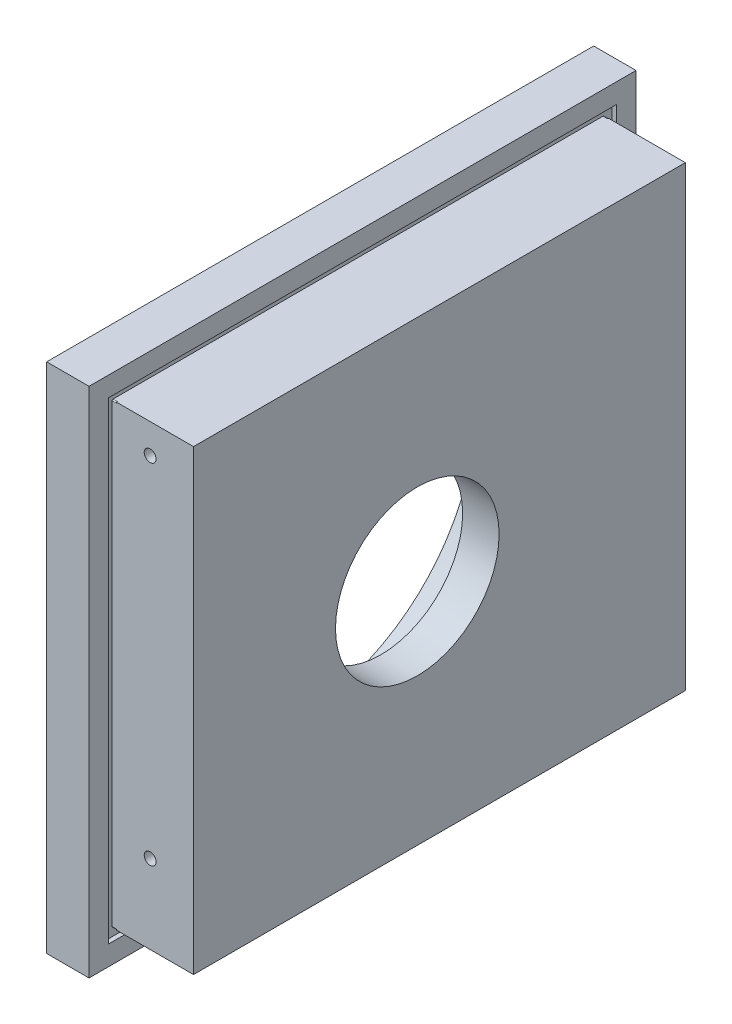
from build123d import *

# Parameters (mm, degrees)
SKETCH1_W                  = 300
SKETCH1_H                  = 260
BOSS_EXTRUDE1_DEPTH        = 60.5
SKETCH2_R                  = 90.15
CUT_EXTRUDE1_DEPTH         = 42
SKETCH9_R                  = 41.51
CUT_EXTRUDE9_DEPTH         = 306
SKETCH12_W                 = 39
SKETCH12_H                 = 260
CUT_EXTRUDE12_DEPTH        = 36.45
SKETCH13_W                 = 39
SKETCH13_H                 = 260
CUT_EXTRUDE13_DEPTH        = 14
SKETCH14_W                 = 39
SKETCH14_H                 = 249.55
CUT_EXTRUDE14_DEPTH        = 14
SKETCH15_W                 = 22.45
SKETCH15_H                 = 260
CUT_EXTRUDE15_DEPTH        = 208.50963833
F_6_0MM_DOWEL_HOLE1_D      = 6
F_6_0MM_DOWEL_HOLE1_DEPTH  = 30
F_6_0MM_DOWEL_HOLE1_TIP    = 1.802581857
F_6_0MM_DOWEL_HOLE2_D      = 6
F_6_0MM_DOWEL_HOLE2_DEPTH  = 30
F_6_0MM_DOWEL_HOLE2_TIP    = 1.802581857
F_6_0MM_DOWEL_HOLE3_D      = 6
F_6_0MM_DOWEL_HOLE3_DEPTH  = 15
F_6_0MM_DOWEL_HOLE3_TIP    = 1.802581857
SKETCH25_W                 = 39
SKETCH25_H                 = 14
CUT_EXTRUDE16_DEPTH        = 313.400788251
SKETCH26_W                 = 257.55
SKETCH26_H                 = 240
CUT_EXTRUDE17_DEPTH        = 2.3
F_10_0MM_DOWEL_HOLE1_D     = 10
F_10_0MM_DOWEL_HOLE1_DEPTH = 15
F_10_0MM_DOWEL_HOLE1_TIP   = 3.004303095
SKETCH31_R                 = 95.65
SKETCH31_R_2               = 91.65
CUT_EXTRUDE18_DEPTH        = 2.3
SKETCH32_R                 = 2.25
CUT_EXTRUDE19_DEPTH        = 68


with BuildPart() as part:
    # Sketch1 → Boss-Extrude1 (new body)
    with BuildSketch(Plane(origin=(0, 0, 0), x_dir=(0, 0, -1), z_dir=(1, 0, 0))):
        Rectangle(SKETCH1_W, SKETCH1_H)
    extrude(amount=BOSS_EXTRUDE1_DEPTH)

    # Sketch2 → Cut-Extrude1 (cut)
    with BuildSketch(Plane(origin=(0, 0, 0), x_dir=(0, 0, -1), z_dir=(1, 0, 0))):
        with Locations(Location((0, 0, 0), (0, 0, 180))):
            Circle(SKETCH2_R)
    extrude(amount=CUT_EXTRUDE1_DEPTH, mode=Mode.SUBTRACT)

    # Sketch9 → Cut-Extrude9 (cut)
    with BuildSketch(Plane(origin=(0, 0, 0), x_dir=(0, 0, -1), z_dir=(1, 0, 0))):
        with Locations(Location((0, 0, 0), (0, 0, 180))):
            Circle(SKETCH9_R)
    extrude(amount=CUT_EXTRUDE9_DEPTH, mode=Mode.SUBTRACT)

    # Sketch12 → Cut-Extrude12 (cut)
    with BuildSketch(Plane.XY.offset(150)):
        with Locations((41, 0)):
            Rectangle(SKETCH12_W, SKETCH12_H)
    extrude(amount=-CUT_EXTRUDE12_DEPTH, mode=Mode.SUBTRACT)

    # Sketch13 → Cut-Extrude13 (cut)
    with BuildSketch(Plane(origin=(0, 0, -150), x_dir=(-1, 0, 0), z_dir=(0, 0, -1))):
        with Locations((-41, 0)):
            Rectangle(SKETCH13_W, SKETCH13_H)
    extrude(amount=-CUT_EXTRUDE13_DEPTH, mode=Mode.SUBTRACT)

    # Sketch14 → Cut-Extrude14 (cut)
    with BuildSketch(Plane(origin=(0, -130, 0), x_dir=(-1, 0, 0), z_dir=(0, -1, 0))):
        with Locations((-41, 11.225)):
            Rectangle(SKETCH14_W, SKETCH14_H)
    extrude(amount=-CUT_EXTRUDE14_DEPTH, mode=Mode.SUBTRACT)

    # Sketch15 → Cut-Extrude15 (cut, through all)
    with BuildSketch(Plane(origin=(0, 0, 0), x_dir=(0, 0, -1), z_dir=(1, 0, 0))):
        with Locations((-138.775, 0)):
            Rectangle(SKETCH15_W, SKETCH15_H)
    extrude(amount=CUT_EXTRUDE15_DEPTH, mode=Mode.SUBTRACT)

    # Ø6.0mm Dowel Hole1
    with Locations(Plane(origin=(0, 0, -136), x_dir=(-1, 0, 0), z_dir=(0, 0, -1))):
        with Locations((-38.5, 101), (-38.5, -76)):
            Hole(F_6_0MM_DOWEL_HOLE1_D / 2, depth=F_6_0MM_DOWEL_HOLE1_DEPTH)
            with Locations((0, 0, -(F_6_0MM_DOWEL_HOLE1_DEPTH + F_6_0MM_DOWEL_HOLE1_TIP / 2))):  # 118° drill point
                Cone(0, F_6_0MM_DOWEL_HOLE1_D / 2, F_6_0MM_DOWEL_HOLE1_TIP, mode=Mode.SUBTRACT)

    # Ø6.0mm Dowel Hole2
    with Locations(Plane.XY.offset(113.55)):
        with Locations((38.5, 101), (38.5, -76)):
            Hole(F_6_0MM_DOWEL_HOLE2_D / 2, depth=F_6_0MM_DOWEL_HOLE2_DEPTH)
            with Locations((0, 0, -(F_6_0MM_DOWEL_HOLE2_DEPTH + F_6_0MM_DOWEL_HOLE2_TIP / 2))):  # 118° drill point
                Cone(0, F_6_0MM_DOWEL_HOLE2_D / 2, F_6_0MM_DOWEL_HOLE2_TIP, mode=Mode.SUBTRACT)

    # Ø6.0mm Dowel Hole3
    with Locations(Plane(origin=(0, -116, 0), x_dir=(-1, 0, 0), z_dir=(0, -1, 0))):
        with Locations((-40, -97.55), (-40, 120)):
            Hole(F_6_0MM_DOWEL_HOLE3_D / 2, depth=F_6_0MM_DOWEL_HOLE3_DEPTH)
            with Locations((0, 0, -(F_6_0MM_DOWEL_HOLE3_DEPTH + F_6_0MM_DOWEL_HOLE3_TIP / 2))):  # 118° drill point
                Cone(0, F_6_0MM_DOWEL_HOLE3_D / 2, F_6_0MM_DOWEL_HOLE3_TIP, mode=Mode.SUBTRACT)

    # Sketch25 → Cut-Extrude16 (cut, through all)
    with BuildSketch(Plane(origin=(0, 0, -150), x_dir=(-1, 0, 0), z_dir=(0, 0, -1))):
        with Locations((-41, 123)):
            Rectangle(SKETCH25_W, SKETCH25_H)
    extrude(amount=-CUT_EXTRUDE16_DEPTH, mode=Mode.SUBTRACT)

    # Sketch26 → Cut-Extrude17 (cut)
    with BuildSketch(Plane(origin=(21.5, 0, 0), x_dir=(0, 0, -1), z_dir=(1, 0, 0))):
        with Locations((11.225, 0)):
            Rectangle(SKETCH26_W, SKETCH26_H)
        with BuildLine():
            Line((-113.05, 116), (135.5, 116))
            ThreePointArc((135.5, 116), (135.853553391, 115.853553391), (136, 115.5))
            Line((136, 115.5), (136, -115.5))
            ThreePointArc((136, -115.5), (135.853553391, -115.853553391), (135.5, -116))
            Line((135.5, -116), (-113.05, -116))
            ThreePointArc((-113.05, -116), (-113.403553391, -115.853553391), (-113.55, -115.5))
            Line((-113.55, -115.5), (-113.55, 115.5))
            ThreePointArc((-113.55, 115.5), (-113.403553391, 115.853553391), (-113.05, 116))
        make_face(mode=Mode.SUBTRACT)
    extrude(amount=-CUT_EXTRUDE17_DEPTH, mode=Mode.SUBTRACT)

    # Ø10.0mm Dowel Hole1
    with Locations(Plane.ZY):
        with Locations((-82.598742079, 69.308574014), (0, 107.825), (82.598742079, 69.308574014), (82.598742079, -69.308574014), (0, -107.825), (-82.598742079, -69.308574014)):
            Hole(F_10_0MM_DOWEL_HOLE1_D / 2, depth=F_10_0MM_DOWEL_HOLE1_DEPTH)
            with Locations((0, 0, -(F_10_0MM_DOWEL_HOLE1_DEPTH + F_10_0MM_DOWEL_HOLE1_TIP / 2))):  # 118° drill point
                Cone(0, F_10_0MM_DOWEL_HOLE1_D / 2, F_10_0MM_DOWEL_HOLE1_TIP, mode=Mode.SUBTRACT)

    # Sketch31 → Cut-Extrude18 (cut)
    with BuildSketch(Plane(origin=(0, 0, 0), x_dir=(0, 0, -1), z_dir=(1, 0, 0))):
        Circle(SKETCH31_R)
        Circle(SKETCH31_R_2, mode=Mode.SUBTRACT)
    extrude(amount=CUT_EXTRUDE18_DEPTH, mode=Mode.SUBTRACT)

    # Sketch32 → Cut-Extrude19 (cut)
    with BuildSketch(Plane(origin=(0, -130, 0), x_dir=(-1, 0, 0), z_dir=(0, -1, 0))):
        with Locations(Location((-9, 9.45, 0), (0, 0, 90))):
            Circle(SKETCH32_R)
    extrude(amount=-CUT_EXTRUDE19_DEPTH, mode=Mode.SUBTRACT)


solid = part.part
